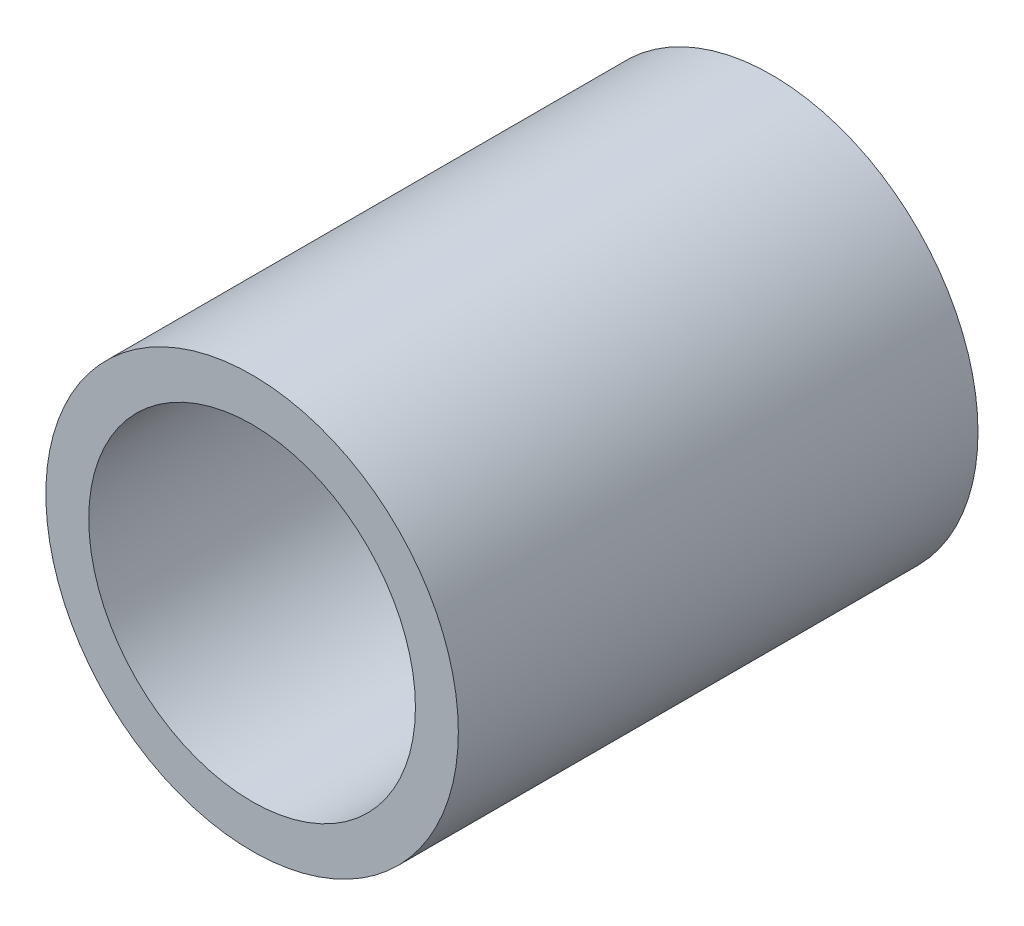
from build123d import *

# Parameters (mm, degrees)
SKETCH1_R           = 7.9375
SKETCH1_R_2         = 6.2865
BOSS_EXTRUDE1_DEPTH = 20


with BuildPart() as part:
    # Sketch1 → Boss-Extrude1 (new body)
    with BuildSketch(Plane.XY):
        Circle(SKETCH1_R)
        Circle(SKETCH1_R_2, mode=Mode.SUBTRACT)
    extrude(amount=BOSS_EXTRUDE1_DEPTH)


solid = part.part
